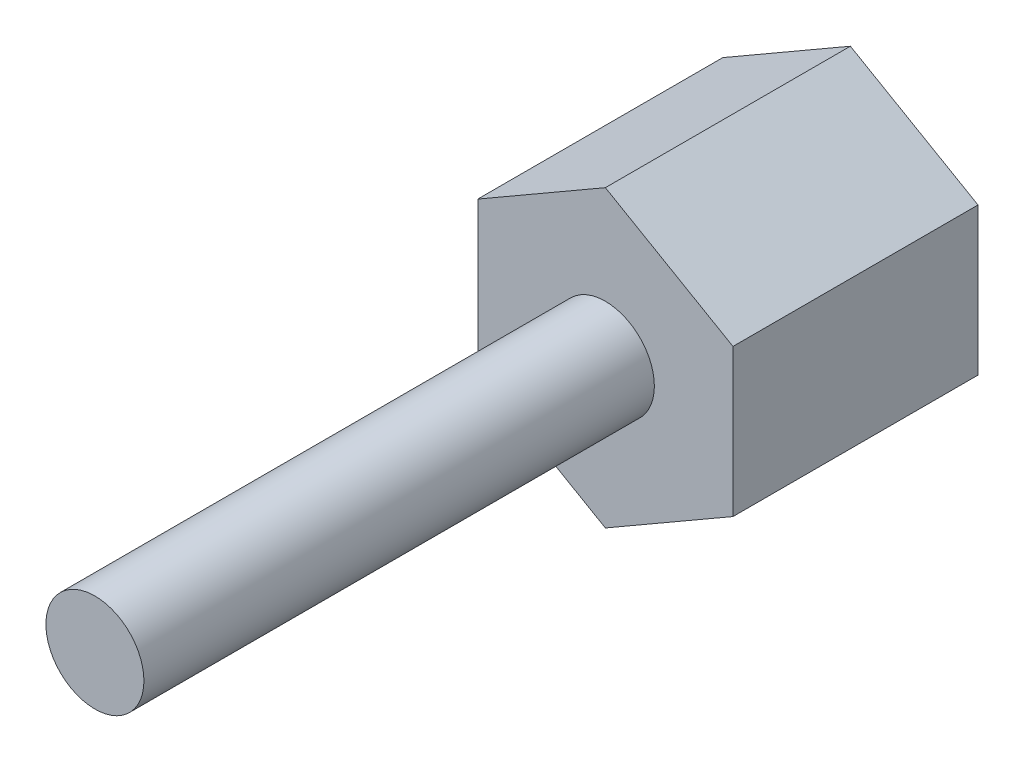
from build123d import *

# Parameters (mm, degrees)
SALIENTE_EXTRUIR1_DEPTH = 12
CROQUIS2_R              = 2.4
SALIENTE_EXTRUIR2_DEPTH = 25


with BuildPart() as part:
    # Croquis1 → Saliente-Extruir1 (new body)
    with BuildSketch(Plane.XY):
        Polygon((0, 7.216878365), (-6.25, 3.608439182), (-6.25, -3.608439182), (0, -7.216878365), (6.25, -3.608439182), (6.25, 3.608439182), align=None)
    extrude(amount=SALIENTE_EXTRUIR1_DEPTH)

    # Croquis2 → Saliente-Extruir2 (add)
    with BuildSketch(Plane.XY.offset(12)):
        Circle(CROQUIS2_R)
    extrude(amount=SALIENTE_EXTRUIR2_DEPTH)


solid = part.part
